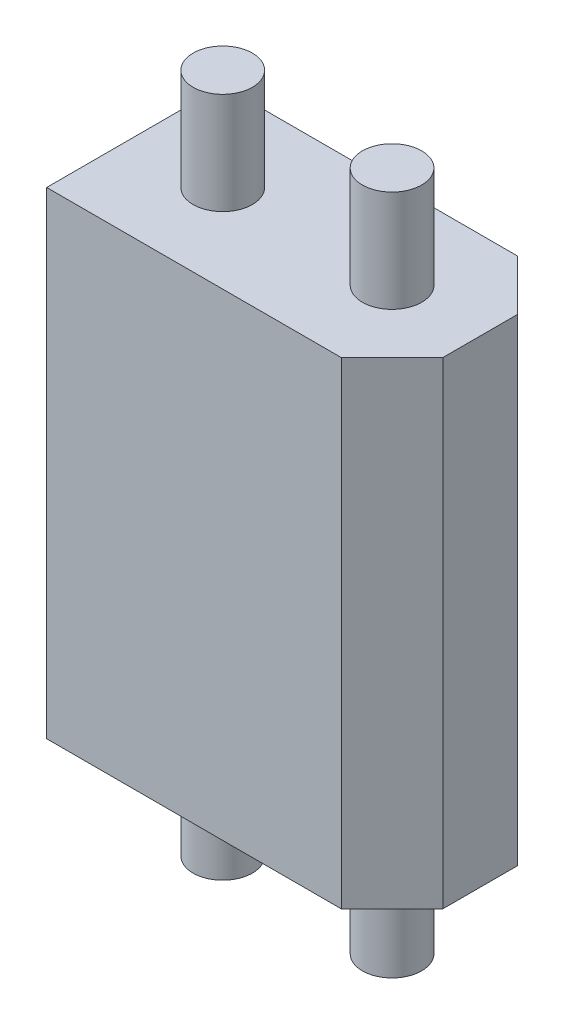
from build123d import *

# Parameters (mm, degrees)
SKETCH1_W                = 10.2
SKETCH1_H                = 5.2
BOSS_EXTRUDE1_DEPTH      = 7.05
CHAMFER1_SIZE            = 1.5
BOSS_EXTRUDE2_DEPTH      = 10.05
BOSS_EXTRUDE2_DEPTH_BACK = 10.05
SKETCH2_R                = 0.875


with BuildPart() as part:
    # Sketch1 → Boss-Extrude1 (new, symmetric)
    with BuildSketch(Plane(origin=(0, 0, 0), x_dir=(1, 0, 0), z_dir=(0, 1, 0))):
        Rectangle(SKETCH1_W, SKETCH1_H)
    extrude(amount=BOSS_EXTRUDE1_DEPTH, both=True)

    # Chamfer1
    chamfer1_edges = [part.edges().sort_by_distance(p)[0] for p in [
        (5.1, 0, 2.6),
        (5.1, 0, -2.6),
    ]]
    chamfer(chamfer1_edges, length=CHAMFER1_SIZE)

    # Sketch2 → Boss-Extrude2 (add, two sides: drawn at the far end of the back side and taken through both)
    with BuildSketch(Plane(origin=(0, 0, 0), x_dir=(1, 0, 0), z_dir=(0, 1, 0)).offset(-BOSS_EXTRUDE2_DEPTH_BACK)):
        with Locations(Location((-2.5, 0, 0), (0, 0, 90))):
            Circle(SKETCH2_R)
        with Locations(Location((2.5, 0, 0), (0, 0, 90))):
            Circle(SKETCH2_R)
    extrude(amount=BOSS_EXTRUDE2_DEPTH + BOSS_EXTRUDE2_DEPTH_BACK)


solid = part.part
